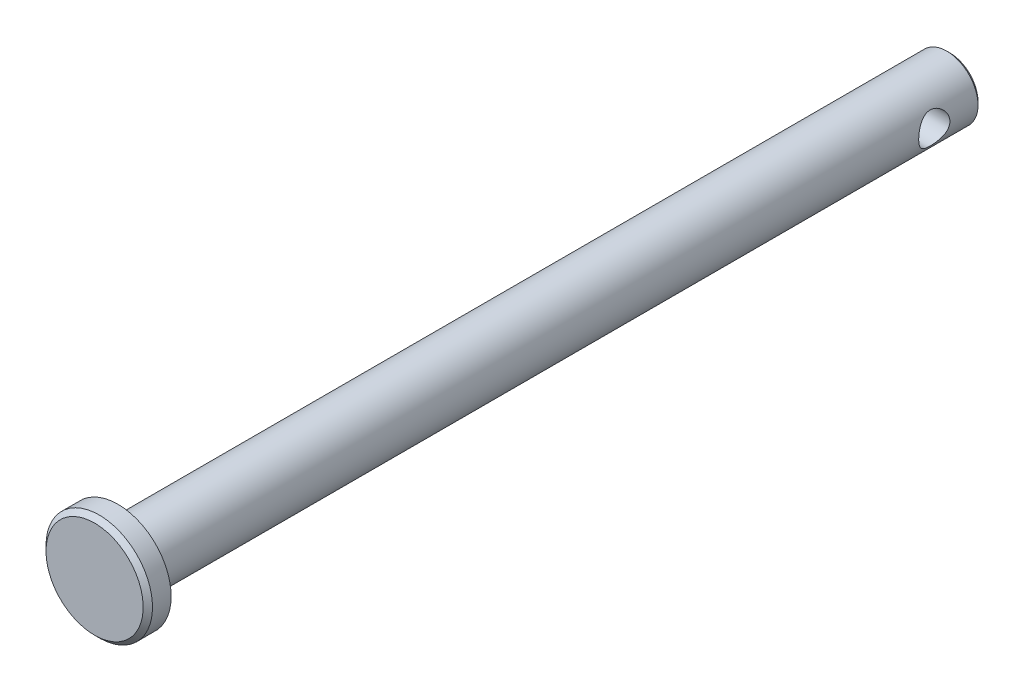
from build123d import *

# Parameters (mm, degrees)
SKETCH1_R           = 2.38125
EXTRUDE1_DEPTH      = 31.75
SKETCH2_R           = 4.064
EXTRUDE2_DEPTH      = 1.778
CHAMFER1_SIZE       = 0.3556
EXTRUDE3_DEPTH      = 35.017039495
EXTRUDE3_DEPTH_BACK = 35.017039495
SKETCH3_R           = 1.190625
CHAMFER2_SIZE       = 0.238125


with BuildPart() as part:
    # Sketch1 → Extrude1 (new, symmetric)
    with BuildSketch(Plane.XY):
        Circle(SKETCH1_R)
    extrude(amount=EXTRUDE1_DEPTH, both=True)

    # Sketch2 → Extrude2 (add)
    with BuildSketch(Plane.XY.offset(31.75)):
        Circle(SKETCH2_R)
    extrude(amount=EXTRUDE2_DEPTH)

    # Chamfer1
    chamfer1_edges = [part.edges().sort_by_distance(p)[0] for p in [
        (-4.064, 0, 33.528),
    ]]
    chamfer(chamfer1_edges, length=CHAMFER1_SIZE)

    # Sketch3 → Extrude3 (cut, two sides: drawn at the far end of the back side and taken through both)
    with BuildSketch(Plane(origin=(0, 0, 0), x_dir=(0, 0, -1), z_dir=(1, 0, 0)).offset(-EXTRUDE3_DEPTH_BACK)):
        with Locations(Location((28.178125, 0, 0), (0, 0, 179.999999999))):
            Circle(SKETCH3_R)
    extrude(amount=EXTRUDE3_DEPTH + EXTRUDE3_DEPTH_BACK, mode=Mode.SUBTRACT)

    # Chamfer2
    chamfer2_edges = [part.edges().sort_by_distance(p)[0] for p in [
        (-2.38125, 0, -31.75),
    ]]
    chamfer(chamfer2_edges, length=CHAMFER2_SIZE)


solid = part.part
